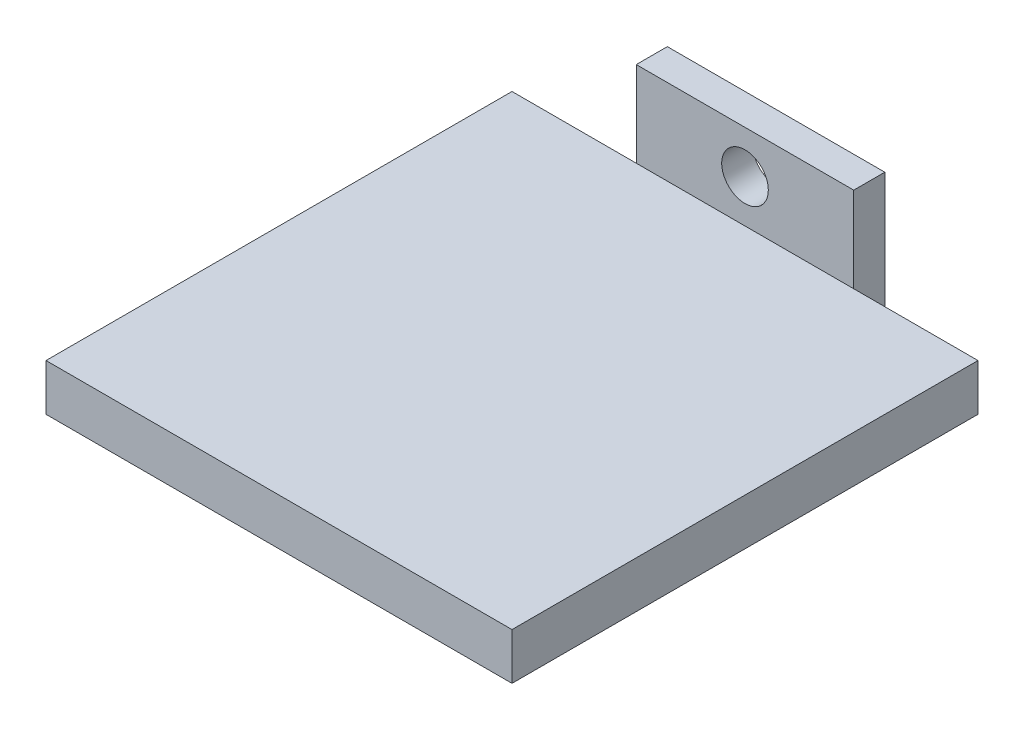
from build123d import *

# Parameters (mm, degrees)
SKETCH1_W             = 14
SKETCH1_H             = 14
BOSS_EXTRUDE1_DEPTH   = 2
SKETCH2_W             = 30
SKETCH2_H             = 3
BOSS_EXTRUDE2_DEPTH   = 30
F_3_0MM_DOWEL_HOLE1_D = 3


with BuildPart() as part:
    # Sketch1 → Boss-Extrude1 (new body)
    with BuildSketch(Plane.XY):
        Rectangle(SKETCH1_W, SKETCH1_H)
    extrude(amount=BOSS_EXTRUDE1_DEPTH)

    # Sketch2 → Boss-Extrude2 (add)
    with BuildSketch(Plane.XY.offset(2)):
        Rectangle(SKETCH2_W, SKETCH2_H)
    extrude(amount=BOSS_EXTRUDE2_DEPTH)

    # Ø3.0mm Dowel Hole1 (through all)
    with Locations(Plane.XY.offset(2)):
        with Locations((0, -4.25), (0, 4.25)):
            Hole(F_3_0MM_DOWEL_HOLE1_D / 2)


solid = part.part
